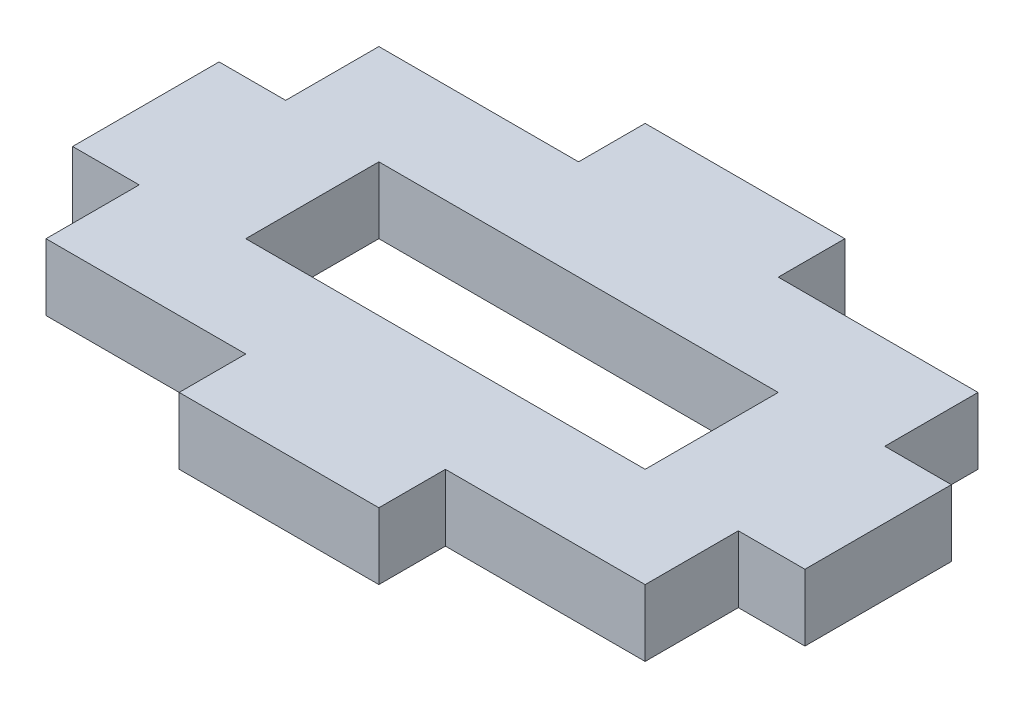
from build123d import *

# Parameters (mm, degrees)
SKETCH1_W           = 30
SKETCH1_H           = 10
BOSS_EXTRUDE1_DEPTH = 5


with BuildPart() as part:
    # Sketch1 → Boss-Extrude1 (new body)
    with BuildSketch(Plane(origin=(0, 0, 0), x_dir=(1, 0, 0), z_dir=(0, 1, 0))):
        Polygon((-22.5, -12.5), (-7.5, -12.5), (-7.5, -17.5), (7.5, -17.5), (7.5, -12.5), (22.5, -12.5), (22.5, -5.5), (27.5, -5.5), (27.5, 5.5), (22.5, 5.5), (22.5, 12.5), (7.5, 12.5), (7.5, 17.5), (-7.5, 17.5), (-7.5, 12.5), (-22.5, 12.5), (-22.5, 5.5), (-27.5, 5.5), (-27.5, -5.5), (-22.5, -5.5), align=None)
        Rectangle(SKETCH1_W, SKETCH1_H, mode=Mode.SUBTRACT)
    extrude(amount=BOSS_EXTRUDE1_DEPTH)


solid = part.part
